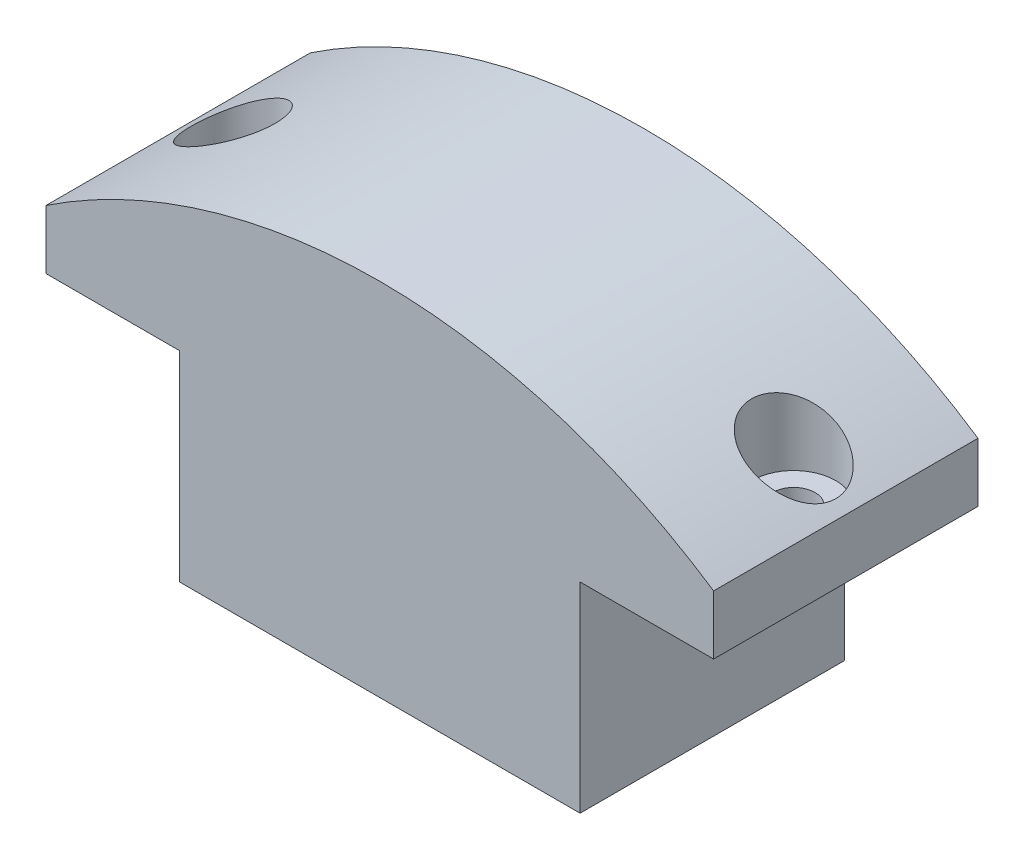
from build123d import *

# Parameters (mm, degrees)
RESSALTO_EXTRUS_O1_DEPTH   = 19.8
ESBO_O3_R                  = 1.6
CORTE_EXTRUS_O1_DEPTH      = 3
CORTE_EXTRUS_O2_REACH      = 38.62
CORTE_EXTRUS_O2_END_RADIUS = 45
ESBO_O4_R                  = 3.15


with BuildPart() as part:
    # Esboço1 → Ressalto-extrusão1 (new body)
    with BuildSketch(Plane.XY):
        with BuildLine():
            Line((-25, 37.416573868), (-25, 32.996573868))
            Line((-25, 32.996573868), (-15, 32.996573868))
            Line((-15, 32.996573868), (-15, 17.996573868))
            Line((-15, 17.996573868), (15, 17.996573868))
            Line((15, 17.996573868), (15, 32.996573868))
            Line((15, 32.996573868), (25, 32.996573868))
            Line((25, 32.996573868), (25, 37.416573868))
            ThreePointArc((25, 37.416573868), (0, 45), (-25, 37.416573868))
        make_face()
    extrude(amount=RESSALTO_EXTRUS_O1_DEPTH)

    # Esboço3 → Corte-extrusão1 (cut)
    with BuildSketch(Plane.XZ.offset(-32.996573868)):
        with Locations(Location((21, 9.8, 0), (0, 0, 270))):
            Circle(ESBO_O3_R)
        with Locations(Location((-21, 9.8, 0), (0, 0, 270))):
            Circle(ESBO_O3_R)
    extrude(amount=-CORTE_EXTRUS_O1_DEPTH, mode=Mode.SUBTRACT)

    # Corte-extrusão2: up to this cylinder (the profile starts inside it)
    corte_extrus_o2_end = Plane(origin=(0, 0, 9.8), z_dir=(0, 0, -1)) * Cylinder(CORTE_EXTRUS_O2_END_RADIUS, 168.24, mode=Mode.PRIVATE)
    # Esboço4 → Corte-extrusão2 (cut, up to the surface)
    with BuildSketch(Plane.XZ.offset(-35.996573868), mode=Mode.PRIVATE) as corte_extrus_o2_sk1:
        with Locations(Location((21, 9.8, 0), (0, 0, 270))):
            Circle(ESBO_O4_R)
    corte_extrus_o2_tool1 = extrude(corte_extrus_o2_sk1.sketch, amount=-CORTE_EXTRUS_O2_REACH, mode=Mode.PRIVATE) & corte_extrus_o2_end
    add(corte_extrus_o2_tool1.solids().sort_by_distance((21, 35.996574, 9.8))[0], mode=Mode.SUBTRACT)
    # Esboço4 → Corte-extrusão2 (cut, up to the surface)
    with BuildSketch(Plane.XZ.offset(-35.996573868), mode=Mode.PRIVATE) as corte_extrus_o2_sk2:
        with Locations(Location((-21, 9.8, 0), (0, 0, 270))):
            Circle(ESBO_O4_R)
    corte_extrus_o2_tool2 = extrude(corte_extrus_o2_sk2.sketch, amount=-CORTE_EXTRUS_O2_REACH, mode=Mode.PRIVATE) & corte_extrus_o2_end
    add(corte_extrus_o2_tool2.solids().sort_by_distance((-21, 35.996574, 9.8))[0], mode=Mode.SUBTRACT)


solid = part.part
